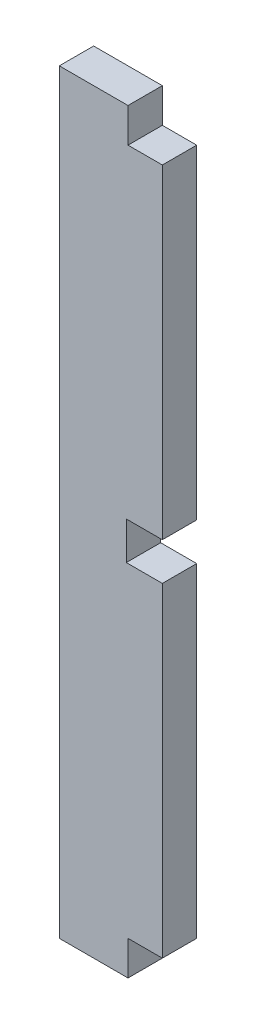
from build123d import *

# Parameters (mm, degrees)
BOSS_EXTRUDE1_DEPTH = 2.5


with BuildPart() as part:
    # Sketch1 → Boss-Extrude1 (new, symmetric)
    with BuildSketch(Plane.XY):
        Polygon((-131.454340614, -213.941167375), (-141.454340614, -213.941167375), (-141.454340614, -103.941167375), (-131.454340614, -103.941167375), (-131.454340614, -108.941167375), (-126.454340614, -108.941167375), (-126.454340614, -156.191167375), (-131.704340614, -156.191167375), (-131.704340614, -161.691167375), (-126.454340614, -161.691167375), (-126.454340614, -208.941167375), (-131.454340614, -208.941167375), align=None)
    extrude(amount=BOSS_EXTRUDE1_DEPTH, both=True)


solid = part.part
